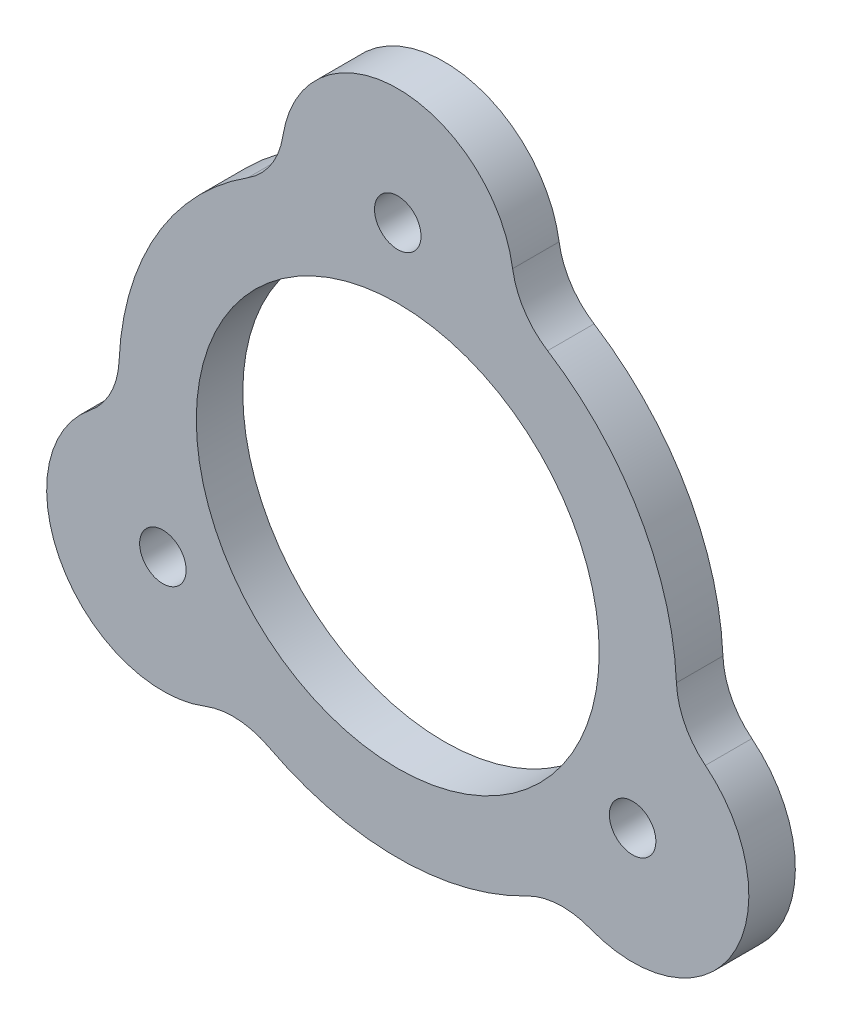
from build123d import *

# Parameters (mm, degrees)
SKETCH_2_R               = 8.75
EXTRUDE_1_DEPTH          = 3
SKETCH_3_R               = 1.5
CUT_EXTRUDE_1_DEPTH      = 34.87136207
PATTERN_CIRCULAR_1_COUNT = 3
PATTERN_CIRCULAR_1_ANGLE = 240
SKETCH_4_R               = 18
EXTRUDE_2_DEPTH          = 3
FILLET_1_R               = 5
SKETCH_5_R               = 13
CUT_EXTRUDE_2_DEPTH      = 34.87136222
SKETCH_6_R               = 1.5
CUT_EXTRUDE_3_DEPTH      = 34.87136222
PATTERN_CIRCULAR_2_COUNT = 3
PATTERN_CIRCULAR_2_ANGLE = 240


with BuildPart() as part:
    # 草图2 → 凸台-拉伸1 (new body)
    with BuildSketch(Plane.XY):
        with BuildLine():
            ThreePointArc((11.405444566, -15.245190528), (21.650635095, -12.5), (18.905444566, -2.254809472))
            ThreePointArc((18.905444566, -2.254809472), (10.556079661, 6.094555434), (7.5, 17.5))
            ThreePointArc((7.5, 17.5), (0, 25), (-7.5, 17.5))
            ThreePointArc((-7.5, 17.5), (-10.556079661, 6.094555434), (-18.905444566, -2.254809472))
            ThreePointArc((-18.905444566, -2.254809472), (-21.650635095, -12.5), (-11.405444566, -15.245190528))
            ThreePointArc((-11.405444566, -15.245190528), (0, -12.189110868), (11.405444566, -15.245190528))
        make_face()
        Circle(SKETCH_2_R, mode=Mode.SUBTRACT)
    extrude(amount=EXTRUDE_1_DEPTH)

    # 草图3 → 切除-拉伸1 (cut, through all)
    with BuildSketch(Plane.XY.offset(3)):
        with Locations((0, 17.5)):
            Circle(SKETCH_3_R)
    cut_extrude_1 = extrude(amount=-CUT_EXTRUDE_1_DEPTH, mode=Mode.SUBTRACT)

    # 阵列(圆周)1: 切除-拉伸1 ×3 about axis
    pattern_circular_1_axis = Axis((0, 0, 0), (0, 0, -1))
    for i in range(1, PATTERN_CIRCULAR_1_COUNT):
        add(cut_extrude_1.rotate(pattern_circular_1_axis, i * PATTERN_CIRCULAR_1_ANGLE / (PATTERN_CIRCULAR_1_COUNT - 1)), mode=Mode.SUBTRACT)

    # 草图4 → 凸台-拉伸2 (add)
    with BuildSketch(Plane.XY.offset(3)):
        Circle(SKETCH_4_R)
    extrude(amount=-EXTRUDE_2_DEPTH)

    # 圆角1
    fillet_1_edges = [part.edges().sort_by_distance(p)[0] for p in [
        (17.923796485, -1.65454512, 1.5),
        (7.529020137, 16.349735649, 1.5),
        (-7.529020137, 16.349735649, 1.5),
        (-17.923796485, -1.65454512, 1.5),
        (-10.394776348, -14.695190528, 1.5),
        (10.394776348, -14.695190528, 1.5),
    ]]
    fillet(fillet_1_edges, radius=FILLET_1_R)

    # 草图5 → 切除-拉伸2 (cut, through all)
    with BuildSketch(Plane.XY.offset(3)):
        Circle(SKETCH_5_R)
    extrude(amount=-CUT_EXTRUDE_2_DEPTH, mode=Mode.SUBTRACT)

    # 草图6 → 切除-拉伸3 (cut, through all)
    with BuildSketch(Plane.XY.offset(3)):
        with Locations((0, 17.5)):
            Circle(SKETCH_6_R)
    extrude(amount=-CUT_EXTRUDE_3_DEPTH, mode=Mode.SUBTRACT)

    # 阵列(圆周)2: 切除-拉伸1 ×3 about axis
    pattern_circular_2_axis = Axis((0, 0, -50.911688245), (0, 0, 1))
    for i in range(1, PATTERN_CIRCULAR_2_COUNT):
        add(cut_extrude_1.rotate(pattern_circular_2_axis, i * PATTERN_CIRCULAR_2_ANGLE / (PATTERN_CIRCULAR_2_COUNT - 1)), mode=Mode.SUBTRACT)


solid = part.part
